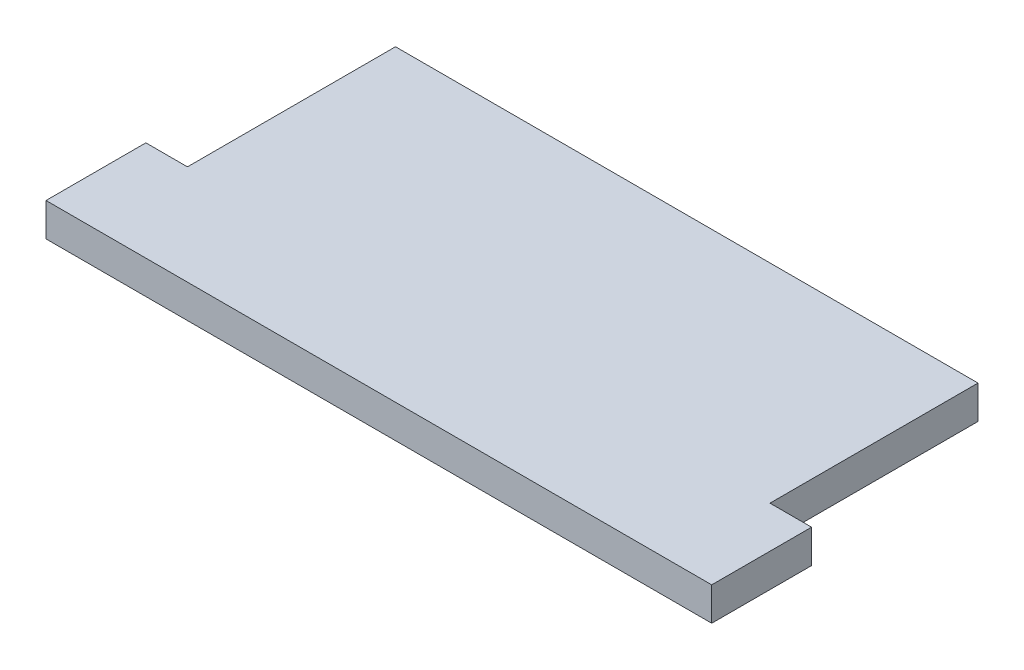
from build123d import *

# Parameters (mm, degrees)
BOSS_EXTRUDE2_DEPTH = 2


with BuildPart() as part:
    # Sketch2 → Boss-Extrude2 (new body)
    with BuildSketch(Plane(origin=(0, 0, 0), x_dir=(1, 0, 0), z_dir=(0, 1, 0))):
        Polygon((0, 0), (40, 0), (40, 6), (37.5, 6), (37.5, 18.5), (2.5, 18.5), (2.5, 6), (0, 6), align=None)
    extrude(amount=BOSS_EXTRUDE2_DEPTH)


solid = part.part
